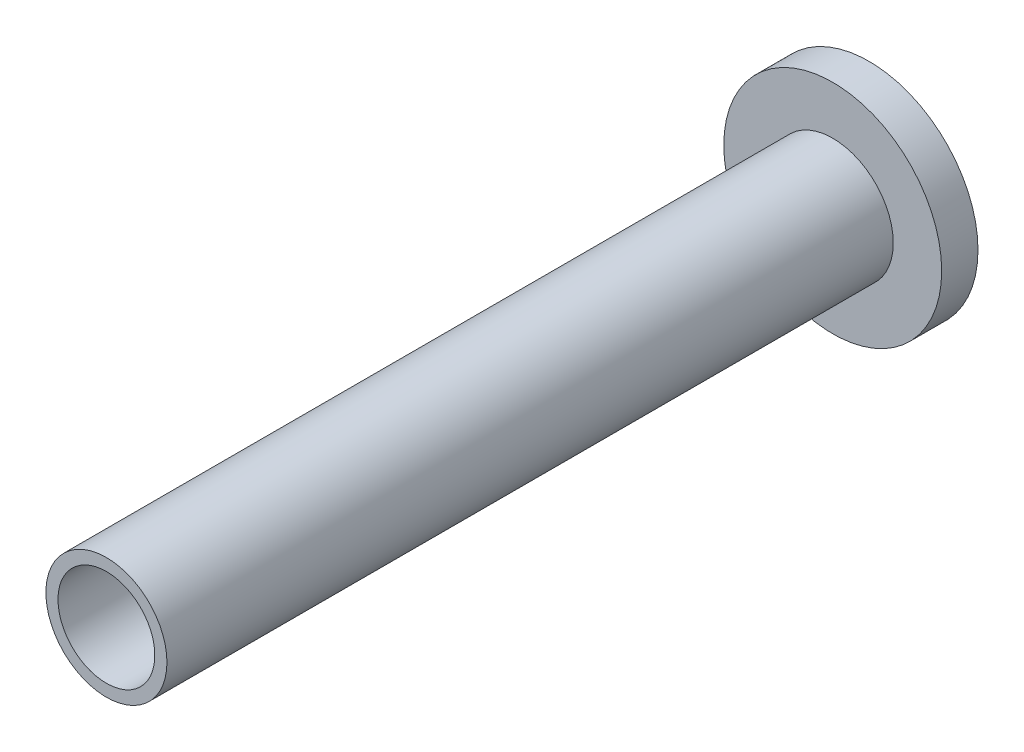
from build123d import *

# Parameters (mm, degrees)
ESQUISSE1_R                  = 2.5
BOSS_EXTRU_1_DEPTH           = 30
ESQUISSE2_R                  = 4.5
BOSS_EXTRU_2_DEPTH           = 1.5
ENL_V_MAT_EXTRU_1_DEPTH      = 33.136427928
ENL_V_MAT_EXTRU_1_DEPTH_BACK = 10
ESQUISSE3_R                  = 2


with BuildPart() as part:
    # Esquisse1 → Boss.-Extru.1 (new body)
    with BuildSketch(Plane.XY):
        Circle(ESQUISSE1_R)
    extrude(amount=BOSS_EXTRU_1_DEPTH)

    # Esquisse2 → Boss.-Extru.2 (add)
    with BuildSketch(Plane.XY):
        Circle(ESQUISSE2_R)
        Polygon((-1.718731116, -0.115769453), (-1.718731116, 0.115769453), (-0.115769453, 0.115769453), (-0.115769453, 1.718731116), (0.115769453, 1.718731116), (0.115769453, 0.115769453), (1.718731116, 0.115769453), (1.718731116, -0.115769453), (0.115769453, -0.115769453), (0.115769453, -1.718731116), (-0.115769453, -1.718731116), (-0.115769453, -0.115769453), align=None, mode=Mode.SUBTRACT)
    extrude(amount=-BOSS_EXTRU_2_DEPTH)

    # Esquisse3 → Enlèv. mat.-Extru.1 (cut, two sides: drawn at the far end of the back side and taken through both)
    with BuildSketch(Plane.XY.offset(30).offset(-ENL_V_MAT_EXTRU_1_DEPTH_BACK)):
        with Locations(Location((0, 0, 0), (0, 0, 180))):
            Circle(ESQUISSE3_R)
    extrude(amount=ENL_V_MAT_EXTRU_1_DEPTH + ENL_V_MAT_EXTRU_1_DEPTH_BACK, mode=Mode.SUBTRACT)


solid = part.part
